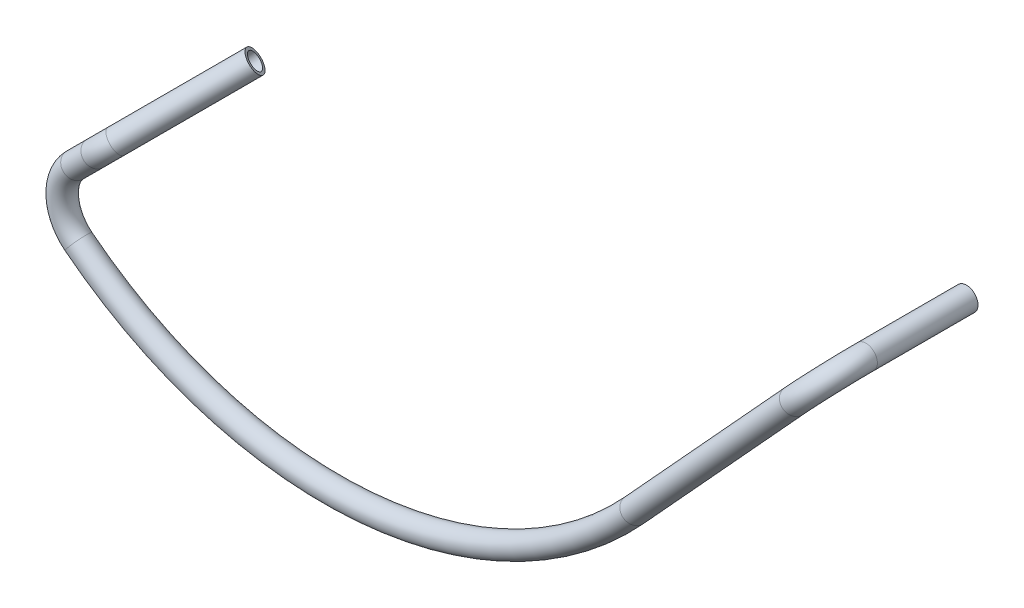
from build123d import *

# Parameters (mm, degrees)
SKETCH3_R   = 0.8
SKETCH3_R_2 = 0.6


with BuildPart() as part:
    # Sweep1: sweep along a curve in space
    with BuildLine() as sweep1_path:
        Line((-15.438861681, -15.438861681, -0.401923789), (-10.113577641, -10.113577641, -4.75))
        ThreePointArc((-16.499521853, -16.499521853, 0), (-15.950483747, -15.950483747, -0.102222521), (-15.438861681, -15.438861681, -0.401923789))
        Line((-17.906004579, -17.906004579, 0), (-16.499521853, -16.499521853, 0))
        ThreePointArc((-17.641705911, -22.383480796, 0), (-18.77947131, -20.204102688, 0), (-17.906004579, -17.906004579, 0))
        ThreePointArc((21.018125806, -19.248074906, 0), (2.303854455, -28.406729038, 0), (-17.641705911, -22.383480796, 0))
        Line((32.122726596, -7.122296221, 0), (21.018125806, -19.248074906, 0))
        ThreePointArc((32.122726596, -7.122296221, 0), (33.555404943, -5.557868927, -0.878679656), (34.148839744, -4.909861925, -3))
        Line((34.148839744, -4.909861925, -3), (34.148839744, -4.909861925, -10))
    # Sketch3 → Sweep1 (sweep)
    with BuildSketch(Plane.XY.offset(-10)):
        with Locations((34.148839744, -4.909861925)):
            Circle(SKETCH3_R)
        with Locations((34.148839744, -4.909861925)):
            Circle(SKETCH3_R_2, mode=Mode.SUBTRACT)
    sweep(path=sweep1_path.line)


solid = part.part
